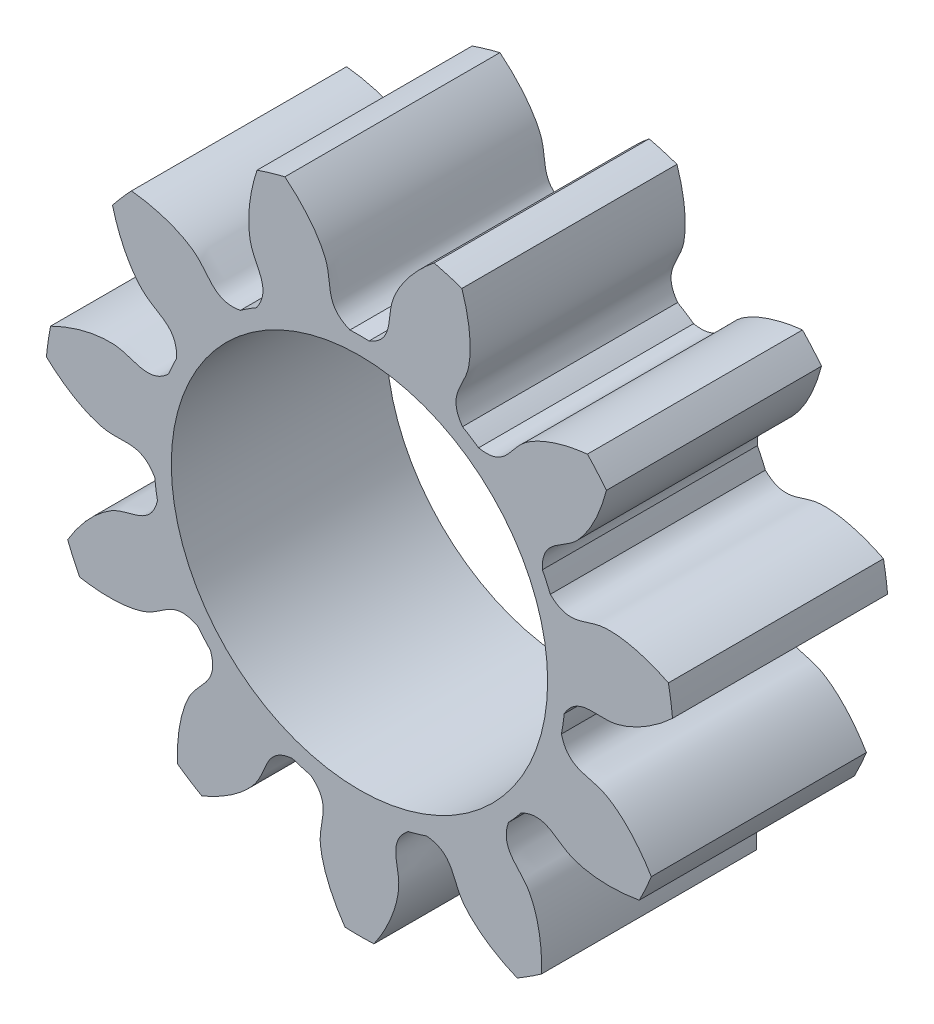
from build123d import *

# Parameters (mm, degrees)
SKETCH_1_R               = 2.925
EXTRUDE_1_DEPTH          = 2
CUT_EXTRUDE_1_DEPTH      = 5.594698031
PATTERN_CIRCULAR_1_COUNT = 11
SKETCH_4_R               = 1.75
CUT_EXTRUDE_2_DEPTH      = 5.586010584


with BuildPart() as part:
    # 草图1 → 凸台-拉伸1 (new body)
    with BuildSketch(Plane.XY):
        Circle(SKETCH_1_R)
    extrude(amount=EXTRUDE_1_DEPTH)

    # 草图2 → 切除-拉伸1 (cut, through all)
    with BuildSketch(Plane.XY):
        with BuildLine():
            ThreePointArc((0.08852987, 1.910449872), (0, 1.9125), (-0.08852987, 1.910449872))
            add(Edge.make_bspline(
                [(-0.08852987, 1.910449872), (-0.315659965, 2.000967152), (-0.258573558, 2.186101094), (-0.30708141, 2.343391426), (-0.309851997, 2.351784125), (-0.313099285, 2.36099721), (-0.316856321, 2.371014779), (-0.321156684, 2.381819732), (-0.326033159, 2.393394013), (-0.331518116, 2.405718553), (-0.337643355, 2.418773307), (-0.344440121, 2.432537255), (-0.351939064, 2.446988429), (-0.360170218, 2.462103917), (-0.369162977, 2.477859886), (-0.378946065, 2.494231597), (-0.389547516, 2.511193422), (-0.40099465, 2.52871886), (-0.413314046, 2.546780561), (-0.426531524, 2.565350339), (-0.440672115, 2.584399192), (-0.455760047, 2.60389733), (-0.471818719, 2.623814185), (-0.488870679, 2.644118439), (-0.506937607, 2.664778045), (-0.526040291, 2.685760249), (-0.54619861, 2.707031611), (-0.567431515, 2.728558032), (-0.589757009, 2.750304773), (-0.613192131, 2.772236485), (-0.637752937, 2.794317231), (-0.663454485, 2.816510508), (-0.690310819, 2.838779279), (-0.718334952, 2.861085995), (-0.747538853, 2.883392624), (-0.777933432, 2.905660673), (-0.809528526, 2.927851221), (-0.842332889, 2.949924944), (-0.876354178, 2.971842142), (-0.911598939, 2.99356277), (-0.948072603, 3.015046462), (-0.985779468, 3.036252566), (-1.024722698, 3.057140166), (-1.064904306, 3.077668119), (-1.106325154, 3.097795078), (-1.14898494, 3.117479524), (-1.192882194, 3.136679798), (-1.238014275, 3.155354129), (-1.284377358, 3.173460665), (-1.331966441, 3.190957502), (-1.380775332, 3.207802719), (-1.430796652, 3.223954403), (-1.482021826, 3.239370684), (-1.552511573, 3.259056282), (-1.606261107, 3.272328319), (-1.642556163, 3.280536787)],
                knots=[0, 0, 0, 0, 0.219011067, 0.222641587, 0.226699227, 0.231183987, 0.236095867, 0.241434867, 0.247200988, 0.253394228, 0.260014588, 0.267062068, 0.274536668, 0.282438388, 0.290767228, 0.299523189, 0.308706269, 0.318316469, 0.328353789, 0.338818229, 0.34970979, 0.36102847, 0.37277427, 0.38494719, 0.39754723, 0.410574391, 0.424028671, 0.437910071, 0.452218591, 0.466954232, 0.482116992, 0.497706872, 0.513723872, 0.530167993, 0.547039233, 0.564337593, 0.582063073, 0.600215674, 0.618795394, 0.637802234, 0.657236195, 0.677097275, 0.697385475, 0.718100796, 0.739243236, 0.760812796, 0.782809477, 0.805233277, 0.828084197, 0.851362238, 0.875067398, 0.899199678, 0.923759079, 0.948745599, 1, 1, 1, 1], degree=3))
            ThreePointArc((-1.642556163, 3.280536787), (0, 3.668775321), (1.642556163, 3.280536787))
            add(Edge.make_bspline(
                [(0.08852987, 1.910449872), (0.315659965, 2.000967152), (0.258573558, 2.186101094), (0.30708141, 2.343391426), (0.309851997, 2.351784125), (0.313099285, 2.36099721), (0.316856321, 2.371014779), (0.321156684, 2.381819732), (0.326033159, 2.393394013), (0.331518116, 2.405718553), (0.337643355, 2.418773307), (0.344440121, 2.432537255), (0.351939064, 2.446988429), (0.360170218, 2.462103917), (0.369162977, 2.477859886), (0.378946065, 2.494231597), (0.389547516, 2.511193422), (0.40099465, 2.52871886), (0.413314046, 2.546780561), (0.426531524, 2.565350339), (0.440672115, 2.584399192), (0.455760047, 2.60389733), (0.471818719, 2.623814185), (0.488870679, 2.644118439), (0.506937607, 2.664778045), (0.526040291, 2.685760249), (0.54619861, 2.707031611), (0.567431515, 2.728558032), (0.589757009, 2.750304773), (0.613192131, 2.772236485), (0.637752937, 2.794317231), (0.663454485, 2.816510508), (0.690310819, 2.838779279), (0.718334952, 2.861085995), (0.747538853, 2.883392624), (0.777933432, 2.905660673), (0.809528526, 2.927851221), (0.842332889, 2.949924944), (0.876354178, 2.971842142), (0.911598939, 2.99356277), (0.948072603, 3.015046462), (0.985779468, 3.036252566), (1.024722698, 3.057140166), (1.064904306, 3.077668119), (1.106325154, 3.097795078), (1.14898494, 3.117479524), (1.192882194, 3.136679798), (1.238014275, 3.155354129), (1.284377358, 3.173460665), (1.331966441, 3.190957502), (1.380775332, 3.207802719), (1.430796652, 3.223954403), (1.482021826, 3.239370684), (1.552511573, 3.259056282), (1.606261107, 3.272328319), (1.642556163, 3.280536787)],
                knots=[0, 0, 0, 0, 0.219011067, 0.222641587, 0.226699227, 0.231183987, 0.236095867, 0.241434867, 0.247200988, 0.253394228, 0.260014588, 0.267062068, 0.274536668, 0.282438388, 0.290767228, 0.299523189, 0.308706269, 0.318316469, 0.328353789, 0.338818229, 0.34970979, 0.36102847, 0.37277427, 0.38494719, 0.39754723, 0.410574391, 0.424028671, 0.437910071, 0.452218591, 0.466954232, 0.482116992, 0.497706872, 0.513723872, 0.530167993, 0.547039233, 0.564337593, 0.582063073, 0.600215674, 0.618795394, 0.637802234, 0.657236195, 0.677097275, 0.697385475, 0.718100796, 0.739243236, 0.760812796, 0.782809477, 0.805233277, 0.828084197, 0.851362238, 0.875067398, 0.899199678, 0.923759079, 0.948745599, 1, 1, 1, 1], degree=3))
        make_face()
    cut_extrude_1 = extrude(amount=CUT_EXTRUDE_1_DEPTH, mode=Mode.SUBTRACT)

    # 阵列(圆周)1: 切除-拉伸1 ×11 about axis
    pattern_circular_1_axis = Axis((0, 0, 2), (0, 0, -1))
    for i in range(1, PATTERN_CIRCULAR_1_COUNT):
        add(cut_extrude_1.rotate(pattern_circular_1_axis, i * 360 / PATTERN_CIRCULAR_1_COUNT), mode=Mode.SUBTRACT)

    # 草图4 → 切除-拉伸2 (cut, through all)
    with BuildSketch(Plane.XY.offset(2)):
        Circle(SKETCH_4_R)
    extrude(amount=-CUT_EXTRUDE_2_DEPTH, mode=Mode.SUBTRACT)


solid = part.part
